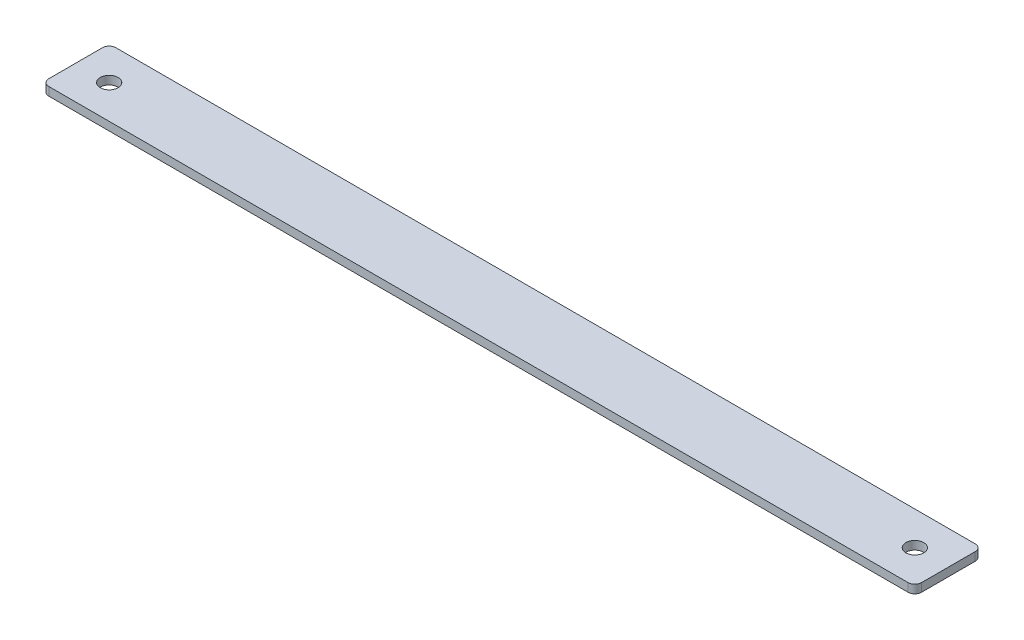
from build123d import *

# Parameters (mm, degrees)
SKETCH2_W           = 330.2
SKETCH2_H           = 25.4
SKETCH2_R           = 3.3734375
BOSS_EXTRUDE1_DEPTH = 3.175
FILLET1_R           = 2.54


with BuildPart() as part:
    # Sketch2 → Boss-Extrude1 (new body)
    with BuildSketch(Plane(origin=(0, 0, 0), x_dir=(1, 0, 0), z_dir=(0, 1, 0))):
        Rectangle(SKETCH2_W, SKETCH2_H)
        with Locations(Location((-152.4, 0, 0), (0, 0, 270))):
            Circle(SKETCH2_R, mode=Mode.SUBTRACT)
        with Locations(Location((152.4, 0, 0), (0, 0, 270))):
            Circle(SKETCH2_R, mode=Mode.SUBTRACT)
    extrude(amount=BOSS_EXTRUDE1_DEPTH)

    # Fillet1
    fillet1_edges = [part.edges().sort_by_distance(p)[0] for p in [
        (165.1, 1.5875, 12.7),
        (-165.1, 1.5875, 12.7),
        (-165.1, 1.5875, -12.7),
        (165.1, 1.5875, -12.7),
    ]]
    fillet(fillet1_edges, radius=FILLET1_R)


solid = part.part
